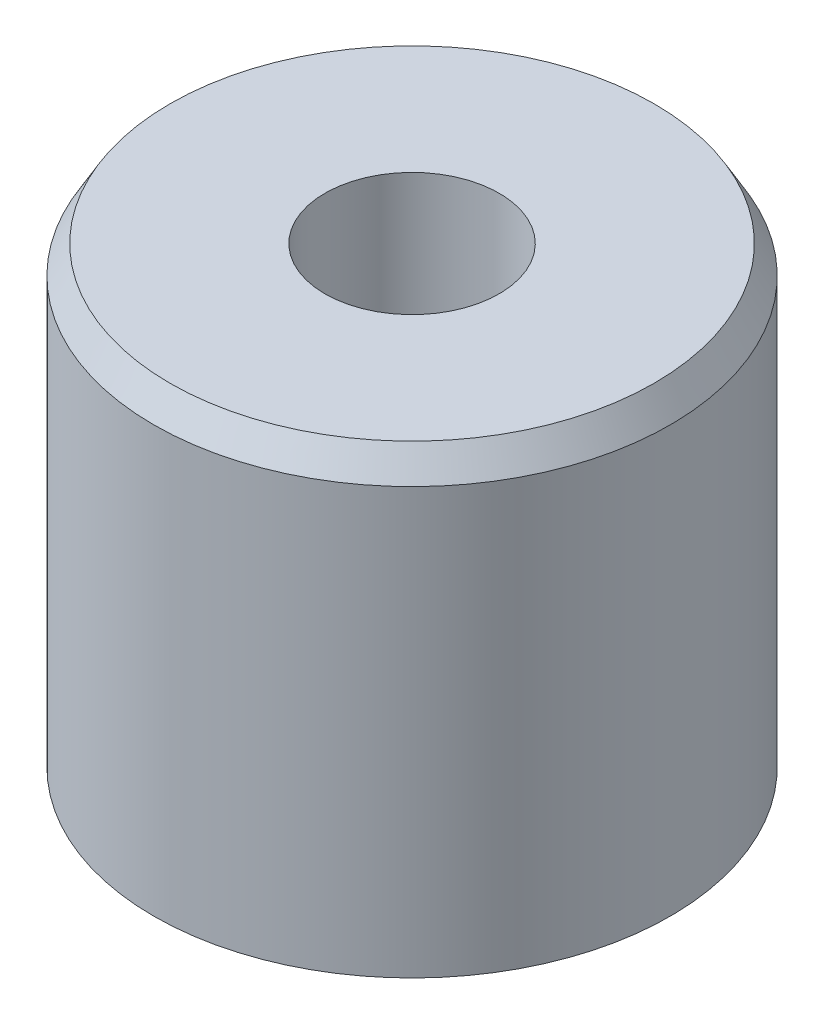
from build123d import *

# Parameters (mm, degrees)
SKETCH1_R           = 8
SKETCH1_R_2         = 2.7
BOSS_EXTRUDE1_DEPTH = 14.05
CHAMFER1_SIZE       = 3
CHAMFER1_SIZE2      = 8.242432258
CHAMFER2_SIZE       = 0.5
CHAMFER2_SIZE2      = 0.866025404


with BuildPart() as part:
    # Sketch1 → Boss-Extrude1 (new body)
    with BuildSketch(Plane(origin=(0, 0, 0), x_dir=(1, 0, 0), z_dir=(0, 1, 0))):
        with Locations(Location((0, 0, 0), (0, 0, 270))):
            Circle(SKETCH1_R)
        with Locations(Location((0, 0, 0), (0, 0, 270))):
            Circle(SKETCH1_R_2, mode=Mode.SUBTRACT)
    extrude(amount=BOSS_EXTRUDE1_DEPTH)

    # Chamfer1
    chamfer1_edges = [part.edges().sort_by_distance(p)[0] for p in [
        (0, 0, -2.7),
    ]]
    chamfer1_side = [part.faces().sort_by_distance(p)[0] for p in [
        (0, 0, -7.77372583),
    ]]
    chamfer(chamfer1_edges, length=CHAMFER1_SIZE, length2=CHAMFER1_SIZE2, reference=chamfer1_side[0])

    # Chamfer2
    chamfer2_edges = [part.edges().sort_by_distance(p)[0] for p in [
        (0, 14.05, -8),
    ]]
    chamfer2_side = [part.faces().sort_by_distance(p)[0] for p in [
        (0, 14.05, -7.77372583),
    ]]
    chamfer(chamfer2_edges, length=CHAMFER2_SIZE, length2=CHAMFER2_SIZE2, reference=chamfer2_side[0])


solid = part.part
